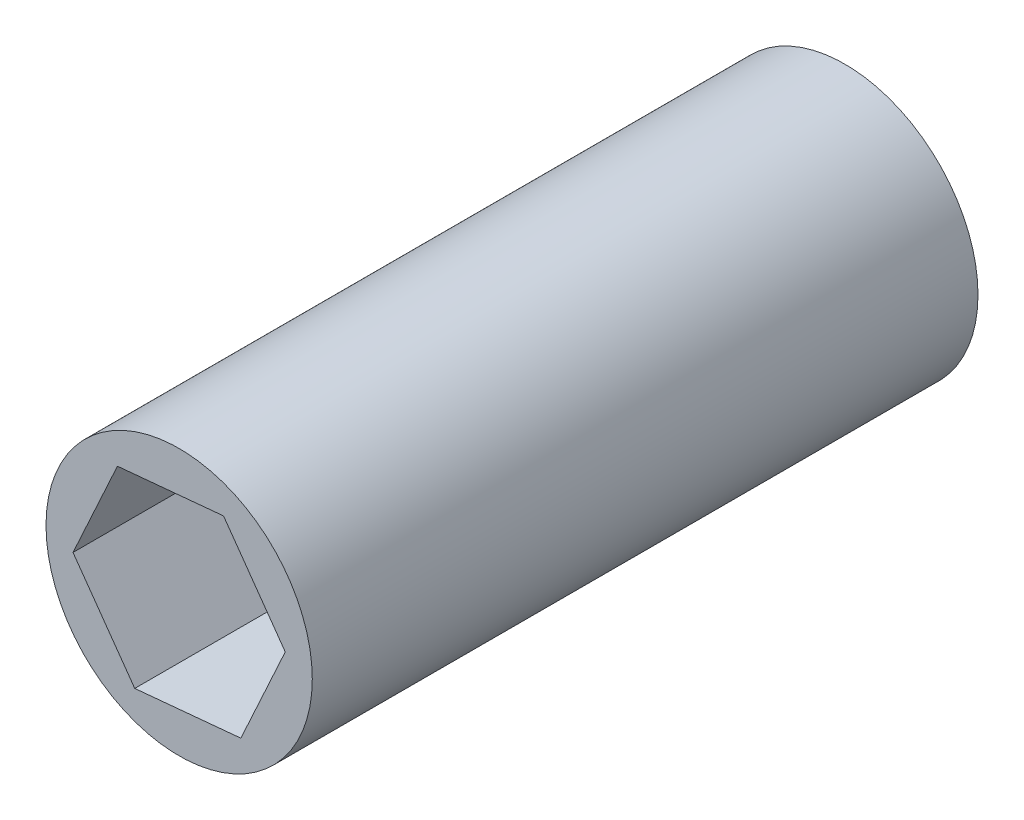
from build123d import *

# Parameters (mm, degrees)
SKETCH1_R           = 9.525
BOSS_EXTRUDE1_DEPTH = 47.625


with BuildPart() as part:
    # Sketch1 → Boss-Extrude1 (new body)
    with BuildSketch(Plane.XY):
        Circle(SKETCH1_R)
        Polygon((-4.415250563, 6.21739365), (-7.592046128, -0.715022327), (-3.176795565, -6.932415977), (4.415250563, -6.21739365), (7.592046128, 0.715022327), (3.176795565, 6.932415977), align=None, mode=Mode.SUBTRACT)
    extrude(amount=BOSS_EXTRUDE1_DEPTH)


solid = part.part
